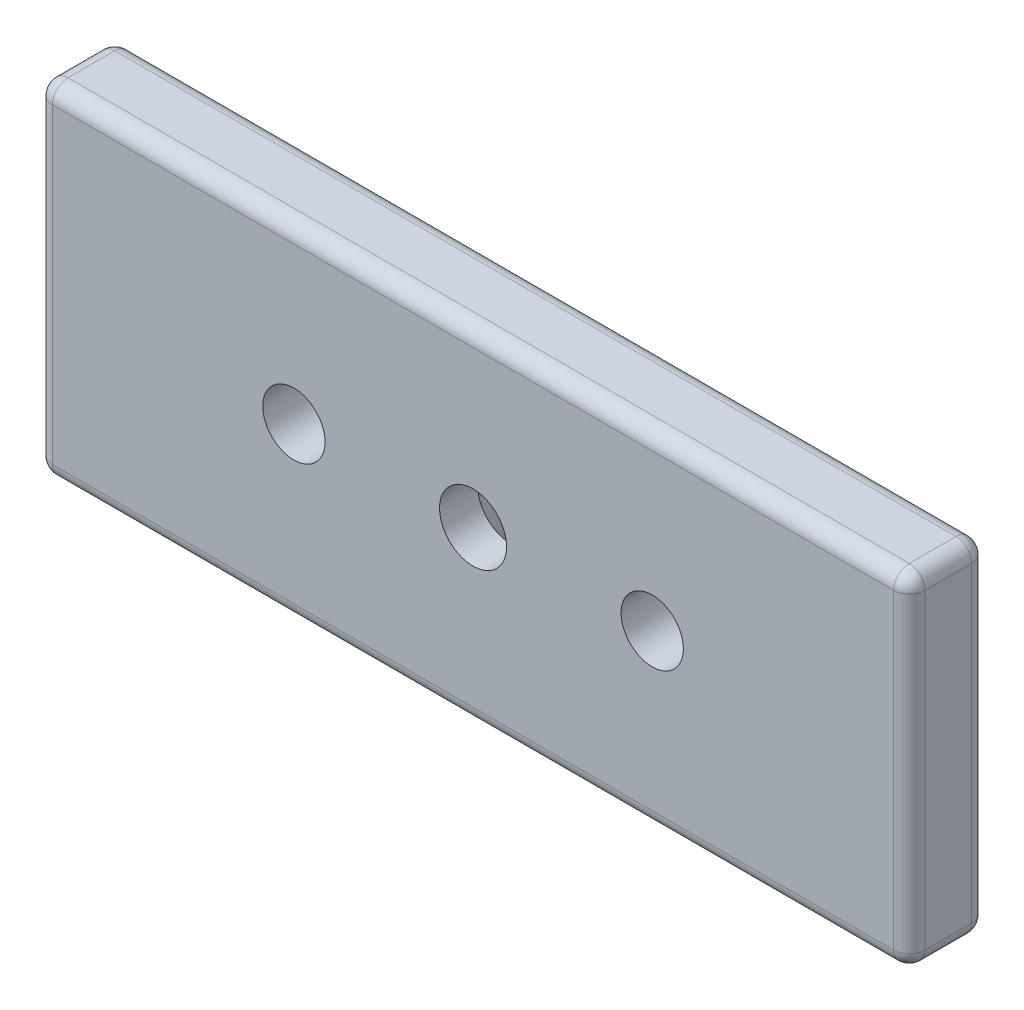
from build123d import *

# Parameters (mm, degrees)
SKETCH_BASE_W                                   = 56
SKETCH_BASE_H                                   = 22
BASE_EXTRUDE_DEPTH                              = 5
SKETCH2_R                                       = 2
MOUNTING_HOLES_DEPTH                            = 61.373835392
SMALL_EDGE_FILLET_R                             = 1
FILLET4_R                                       = 1
CSK_FOR_M4_FLAT_HEAD_MACHINE_SCREW4_D           = 4.3
CSK_FOR_M4_FLAT_HEAD_MACHINE_SCREW4_CSINK_D     = 9.4
CSK_FOR_M4_FLAT_HEAD_MACHINE_SCREW4_CSINK_ANGLE = 90


with BuildPart() as part:
    # Sketch-Base → Base-Extrude (new body)
    with BuildSketch(Plane.XY):
        with Locations((28, 11)):
            Rectangle(SKETCH_BASE_W, SKETCH_BASE_H)
    extrude(amount=BASE_EXTRUDE_DEPTH)

    # Sketch2 → Mounting Holes (cut, through all)
    with BuildSketch(Plane.XY.offset(5)):
        with Locations((16.5, 11)):
            Circle(SKETCH2_R)
        with Locations((39.5, 11)):
            Circle(SKETCH2_R)
    extrude(amount=-MOUNTING_HOLES_DEPTH, mode=Mode.SUBTRACT)

    # Small Edge Fillet
    small_edge_fillet_edges = [part.edges().sort_by_distance(p)[0] for p in [
        (0, 22, 2.5),
        (56, 22, 2.5),
        (56, 0, 2.5),
        (0, 0, 2.5),
    ]]
    fillet(small_edge_fillet_edges, radius=SMALL_EDGE_FILLET_R)

    # Fillet4
    fillet4_edges = [part.edges().sort_by_distance(p)[0] for p in [
        (28, 22, 0),
        (28, 22, 5),
        (0, 11, 0),
        (56, 11, 0),
        (28, 0, 0),
        (0.292893219, 21.707106781, 0),
        (0.292893219, 0.292893219, 0),
        (55.707106781, 0.292893219, 0),
        (55.707106781, 21.707106781, 0),
        (56, 11, 5),
        (0, 11, 5),
        (28, 0, 5),
        (0.292893219, 21.707106781, 5),
        (0.292893219, 0.292893219, 5),
        (55.707106781, 0.292893219, 5),
        (55.707106781, 21.707106781, 5),
    ]]
    fillet(fillet4_edges, radius=FILLET4_R)

    # CSK for M4 Flat Head Machine Screw4 (through all)
    with Locations(Plane(origin=(28, 11, 0), x_dir=(-1, 0, 0), z_dir=(0, 0, -1))):
        with Locations((0, 0)):
            CounterSinkHole(CSK_FOR_M4_FLAT_HEAD_MACHINE_SCREW4_D / 2, CSK_FOR_M4_FLAT_HEAD_MACHINE_SCREW4_CSINK_D / 2, counter_sink_angle=CSK_FOR_M4_FLAT_HEAD_MACHINE_SCREW4_CSINK_ANGLE)


solid = part.part
